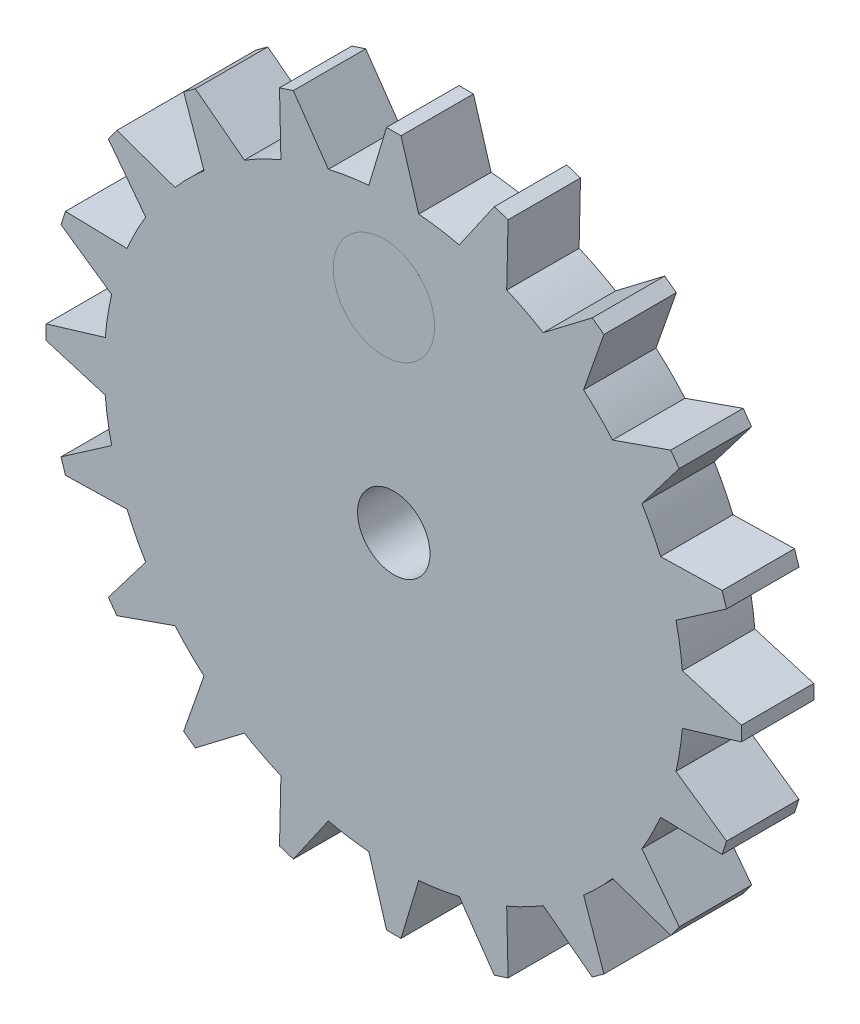
from build123d import *

# Parameters (mm, degrees)
SKETCH1_R           = 40
BOSS_EXTRUDE1_DEPTH = 10
SKETCH2_R           = 5
CUT_EXTRUDE1_DEPTH  = 10
BOSS_EXTRUDE2_DEPTH = 10
SKETCH4_R           = 5
BOSS_EXTRUDE3_DEPTH = 0.0001
SKETCH5_R           = 7
BOSS_EXTRUDE4_DEPTH = 0.0001
SKETCH6_R           = 15
BOSS_EXTRUDE5_DEPTH = 3
CUT_EXTRUDE2_START  = -3
SKETCH7_R           = 5
CUT_EXTRUDE2_DEPTH  = 3


with BuildPart() as part:
    # Sketch1 → Boss-Extrude1 (new body)
    with BuildSketch(Plane.XY):
        Circle(SKETCH1_R)
    extrude(amount=BOSS_EXTRUDE1_DEPTH)

    # Sketch2 → Cut-Extrude1 (cut)
    with BuildSketch(Plane.XY.offset(10)):
        Circle(SKETCH2_R)
    extrude(amount=-CUT_EXTRUDE1_DEPTH, mode=Mode.SUBTRACT)

    # Sketch3 → Boss-Extrude2 (add)
    with BuildSketch(Plane.XY.offset(10)):
        Polygon((-1, 48), (1, 48), (4, 38), (-4, 38), align=None)
        Polygon((7.938419721, 37.376215597), (13.881759214, 45.959729777), (15.783872246, 45.341695788), (15.546871851, 34.904079642), align=None)
        Polygon((19.09977161, 33.093786795), (27.404675116, 39.420600982), (29.022709104, 38.245030478), (25.571907565, 28.391504777), align=None)
        Polygon((28.391504777, 25.571907565), (38.245030478, 29.022709104), (39.420600982, 27.404675116), (33.093786795, 19.09977161), align=None)
        Polygon((34.904079642, 15.546871851), (45.341695788, 15.783872246), (45.959729777, 13.881759214), (37.376215597, 7.938419721), align=None)
        Polygon((38, 4), (48, 1), (48, -1), (38, -4), align=None)
        Polygon((37.376215597, -7.938419721), (45.959729777, -13.881759214), (45.341695788, -15.783872246), (34.904079642, -15.546871851), align=None)
        Polygon((33.093786795, -19.09977161), (39.420600982, -27.404675116), (38.245030478, -29.022709104), (28.391504777, -25.571907565), align=None)
        Polygon((25.571907565, -28.391504777), (29.022709104, -38.245030478), (27.404675116, -39.420600982), (19.09977161, -33.093786795), align=None)
        Polygon((15.546871851, -34.904079642), (15.783872246, -45.341695788), (13.881759214, -45.959729777), (7.938419721, -37.376215597), align=None)
        Polygon((4, -38), (1, -48), (-1, -48), (-4, -38), align=None)
        Polygon((-7.938419721, -37.376215597), (-13.881759214, -45.959729777), (-15.783872246, -45.341695788), (-15.546871851, -34.904079642), align=None)
        Polygon((-19.09977161, -33.093786795), (-27.404675116, -39.420600982), (-29.022709104, -38.245030478), (-25.571907565, -28.391504777), align=None)
        Polygon((-28.391504777, -25.571907565), (-38.245030478, -29.022709104), (-39.420600982, -27.404675116), (-33.093786795, -19.09977161), align=None)
        Polygon((-34.904079642, -15.546871851), (-45.341695788, -15.783872246), (-45.959729777, -13.881759214), (-37.376215597, -7.938419721), align=None)
        Polygon((-38, -4), (-48, -1), (-48, 1), (-38, 4), align=None)
        Polygon((-37.376215597, 7.938419721), (-45.959729777, 13.881759214), (-45.341695788, 15.783872246), (-34.904079642, 15.546871851), align=None)
        Polygon((-33.093786795, 19.09977161), (-39.420600982, 27.404675116), (-38.245030478, 29.022709104), (-28.391504777, 25.571907565), align=None)
        Polygon((-25.571907565, 28.391504777), (-29.022709104, 38.245030478), (-27.404675116, 39.420600982), (-19.09977161, 33.093786795), align=None)
        Polygon((-15.546871851, 34.904079642), (-15.783872246, 45.341695788), (-13.881759214, 45.959729777), (-7.938419721, 37.376215597), align=None)
    extrude(amount=-BOSS_EXTRUDE2_DEPTH)

    # Sketch4 → Boss-Extrude3 (add)
    with BuildSketch(Plane.XY.offset(10)):
        with Locations((-1.366858005, 27.473845905)):
            Circle(SKETCH4_R)
    extrude(amount=BOSS_EXTRUDE3_DEPTH)

    # Sketch5 → Boss-Extrude4 (add)
    with BuildSketch(Plane.XY.offset(10)):
        with Locations((-1.366858005, 27.473845905)):
            Circle(SKETCH5_R)
    extrude(amount=BOSS_EXTRUDE4_DEPTH)

    # Sketch6 → Boss-Extrude5 (add)
    with BuildSketch(Plane(origin=(0, 0, 0), x_dir=(-1, 0, 0), z_dir=(0, 0, -1))):
        with Locations(Location((0, 0, 0), (0, 0, 180))):
            Circle(SKETCH6_R)
    extrude(amount=BOSS_EXTRUDE5_DEPTH)

    # Sketch7 → Cut-Extrude2 (cut)
    with BuildSketch(Plane(origin=(0, 0, -3), x_dir=(-1, 0, 0), z_dir=(0, 0, -1)).offset(CUT_EXTRUDE2_START)):
        with Locations(Location((0, 0, 0), (0, 0, 180))):
            Circle(SKETCH7_R)
    extrude(amount=CUT_EXTRUDE2_DEPTH, mode=Mode.SUBTRACT)


solid = part.part
